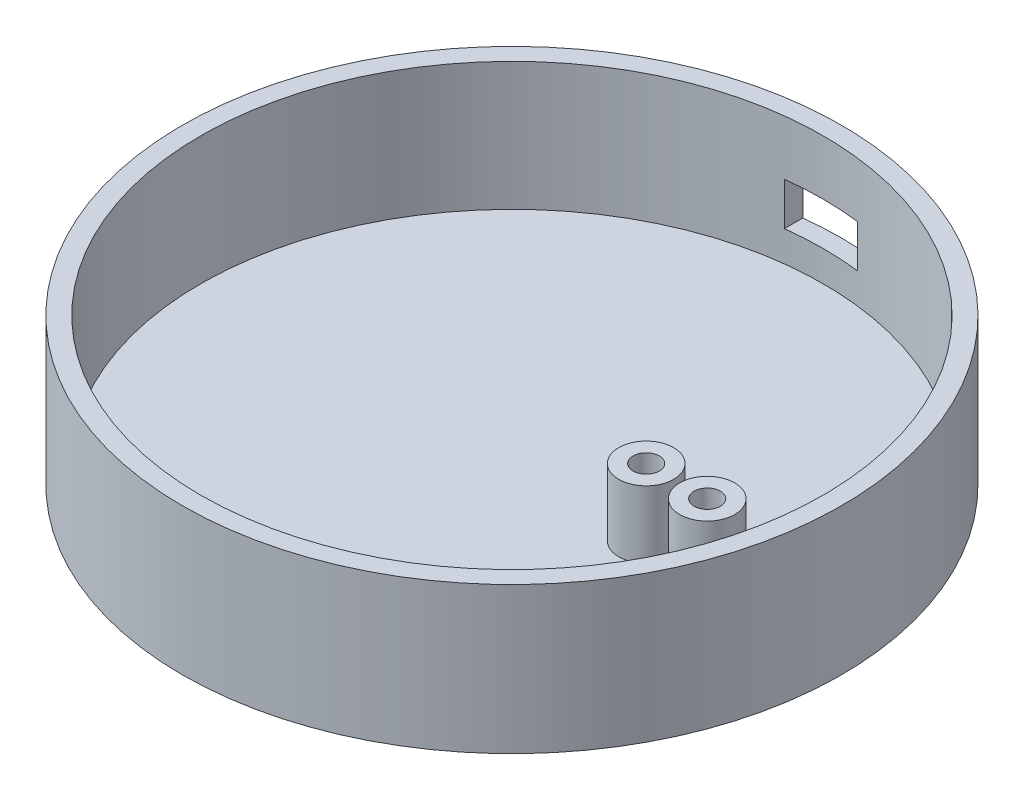
from build123d import *

# Parameters (mm, degrees)
SKETCH_1_R                     = 54
FLOOR_D108_T3_DEPTH            = 3
SKETCH_2_R                     = 54
SKETCH_2_R_2                   = 51
RIM_OD108_ID102_H24_DEPTH      = 24
SKETCH_3_R                     = 4.5
SENSOR_FIXED_POSTS_DEPTH       = 14
SKETCH_4_R                     = 2.15
M4_FIXED_MOUNT_CLEARANCE_DEPTH = 14
SKETCH_5_W                     = 12
SKETCH_5_H                     = 11
USB_C_SIDE_OPENING_12X7_DEPTH  = 7


with BuildPart() as part:
    # 草图1 → Floor_D108_T3 (new body)
    with BuildSketch(Plane(origin=(0, 0, 0), x_dir=(1, 0, 0), z_dir=(0, 1, 0))):
        with Locations(Location((0, 0, 0), (0, 0, 270))):
            Circle(SKETCH_1_R)
    extrude(amount=FLOOR_D108_T3_DEPTH)

    # 草图2 → Rim_OD108_ID102_H24 (add)
    with BuildSketch(Plane(origin=(0, 0, 0), x_dir=(1, 0, 0), z_dir=(0, 1, 0))):
        with Locations(Location((0, 0, 0), (0, 0, 270))):
            Circle(SKETCH_2_R)
        with Locations(Location((0, 0, 0), (0, 0, 270))):
            Circle(SKETCH_2_R_2, mode=Mode.SUBTRACT)
    extrude(amount=RIM_OD108_ID102_H24_DEPTH)

    # 草图3 → Sensor_fixed_posts (add)
    with BuildSketch(Plane(origin=(0, 0, 0), x_dir=(1, 0, 0), z_dir=(0, 1, 0))):
        with Locations(Location((22, 0, 0), (0, 0, 270))):
            Circle(SKETCH_3_R)
        with Locations(Location((32, 0, 0), (0, 0, 270))):
            Circle(SKETCH_3_R)
    extrude(amount=SENSOR_FIXED_POSTS_DEPTH)

    # 草图4 → M4_fixed_mount_clearance (cut)
    with BuildSketch(Plane(origin=(0, 0, 0), x_dir=(1, 0, 0), z_dir=(0, 1, 0))):
        with Locations(Location((22, 0, 0), (0, 0, 270))):
            Circle(SKETCH_4_R)
        with Locations(Location((32, 0, 0), (0, 0, 270))):
            Circle(SKETCH_4_R)
    extrude(amount=M4_FIXED_MOUNT_CLEARANCE_DEPTH, mode=Mode.SUBTRACT)

    # 草图5 → USB_C_side_opening_12x7 (cut)
    with BuildSketch(Plane(origin=(0, 8, 0), x_dir=(1, 0, 0), z_dir=(0, 1, 0))):
        with Locations((0, 54.5)):
            Rectangle(SKETCH_5_W, SKETCH_5_H)
    extrude(amount=USB_C_SIDE_OPENING_12X7_DEPTH, mode=Mode.SUBTRACT)


solid = part.part
